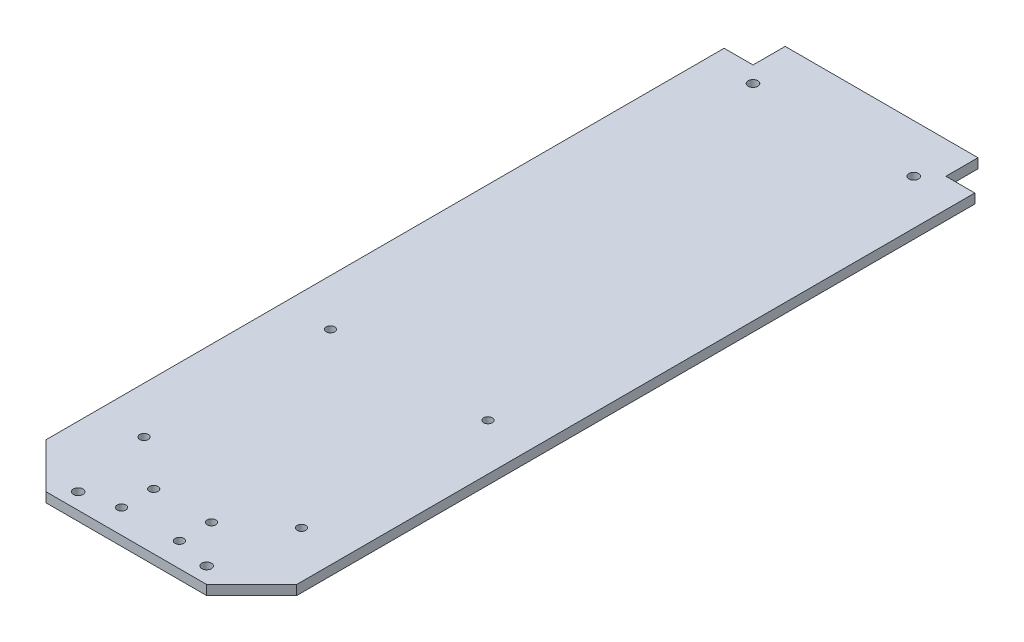
from build123d import *

# Parameters (mm, degrees)
BOSS_EXTRUDE1_DEPTH = 3
SKETCH2_R           = 1.5
SKETCH2_R_2         = 1.35
CUT_EXTRUDE1_DEPTH  = 25
CHAMFER1_SIZE       = 14


with BuildPart() as part:
    # Sketch1 → Boss-Extrude1 (new body)
    with BuildSketch(Plane(origin=(0, 0, 0), x_dir=(1, 0, 0), z_dir=(0, 1, 0))):
        Polygon((19.120621977, 112.5), (28.120621977, 112.5), (28.120621977, -112.5), (-49.879378023, -112.5), (-49.879378023, 112.5), (-40.879378023, 112.5), (-40.879378023, 122.5), (19.120621977, 122.5), align=None)
    extrude(amount=BOSS_EXTRUDE1_DEPTH)

    # Sketch2 → Cut-Extrude1 (cut)
    with BuildSketch(Plane(origin=(0, 3, 0), x_dir=(1, 0, 0), z_dir=(0, 1, 0))):
        with Locations(Location((14.120621977, 107.5, 0), (0, 0, 270))):
            Circle(SKETCH2_R)
        with Locations(Location((-35.879378023, 107.5, 0), (0, 0, 270))):
            Circle(SKETCH2_R)
        with Locations(Location((-30.879378023, -107.5, 0), (0, 0, 270))):
            Circle(SKETCH2_R)
        with Locations(Location((9.120621977, -107.5, 0), (0, 0, 270))):
            Circle(SKETCH2_R)
        with Locations(Location((-35.379378023, -82.5, 0), (0, 0, 270))):
            Circle(SKETCH2_R_2)
        with Locations(Location((13.620621977, -82.5, 0), (0, 0, 270))):
            Circle(SKETCH2_R_2)
        with Locations(Location((-35.379378023, -24.5, 0), (0, 0, 270))):
            Circle(SKETCH2_R_2)
        with Locations(Location((13.620621977, -24.5, 0), (0, 0, 270))):
            Circle(SKETCH2_R_2)
        with Locations(Location((-19.879378023, -105, 0), (0, 0, 270))):
            Circle(SKETCH2_R_2)
        with Locations(Location((-1.879378023, -105, 0), (0, 0, 270))):
            Circle(SKETCH2_R_2)
        with Locations(Location((-19.879378023, -95, 0), (0, 0, 270))):
            Circle(SKETCH2_R_2)
        with Locations(Location((-1.879378023, -95, 0), (0, 0, 270))):
            Circle(SKETCH2_R_2)
    extrude(amount=-CUT_EXTRUDE1_DEPTH, mode=Mode.SUBTRACT)

    # Chamfer1
    chamfer1_edges = [part.edges().sort_by_distance(p)[0] for p in [
        (28.120621977, 1.5, 112.5),
        (-49.879378023, 1.5, 112.5),
    ]]
    chamfer(chamfer1_edges, length=CHAMFER1_SIZE)


solid = part.part
